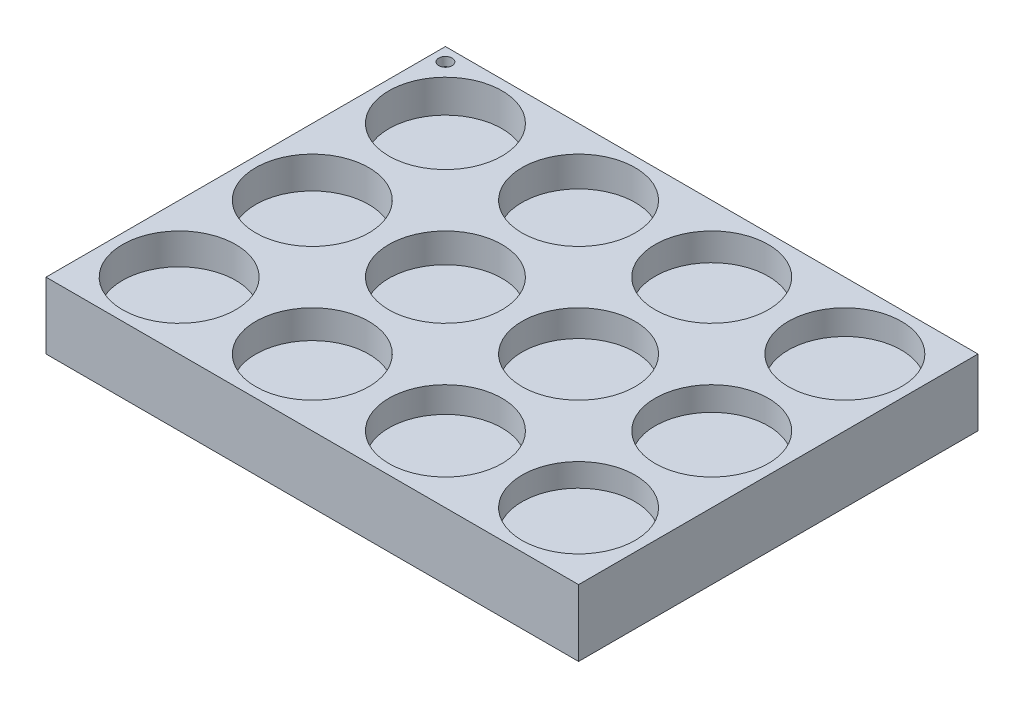
from build123d import *

# Parameters (mm, degrees)
SKETCH1_W           = 120
SKETCH1_H           = 90
SKETCH1_R           = 5
BOSS_EXTRUDE1_DEPTH = 5
SKETCH3_W           = 120
SKETCH3_H           = 90
BOSS_EXTRUDE6_DEPTH = 10
SKETCH2_R           = 12.75
CUT_EXTRUDE1_DEPTH  = 7.4
SKETCH2_8_R         = 12.75
CUT_EXTRUDE2_DEPTH  = 7.2
SKETCH2_9_R         = 12.75
CUT_EXTRUDE3_DEPTH  = 7
SKETCH2_10_R        = 12.75
CUT_EXTRUDE4_DEPTH  = 6.8
SKETCH2_11_R        = 12.75
CUT_EXTRUDE5_DEPTH  = 6.6
SKETCH2_12_R        = 12.75
CUT_EXTRUDE6_DEPTH  = 6.4
SKETCH2_13_R        = 12.75
CUT_EXTRUDE7_DEPTH  = 6.2
SKETCH2_14_R        = 12.75
CUT_EXTRUDE8_DEPTH  = 6
SKETCH2_15_R        = 12.75
CUT_EXTRUDE9_DEPTH  = 5.8
SKETCH2_16_R        = 12.75
CUT_EXTRUDE10_DEPTH = 5.6
SKETCH2_17_R        = 12.75
CUT_EXTRUDE11_DEPTH = 5.4
SKETCH2_18_R        = 12.75
CUT_EXTRUDE12_DEPTH = 5.2
SKETCH4_R           = 1.5
CUT_EXTRUDE13_DEPTH = 2


with BuildPart() as part:
    # Sketch1 → Boss-Extrude1 (new body)
    with BuildSketch(Plane(origin=(0, 0, 0), x_dir=(1, 0, 0), z_dir=(0, 1, 0))):
        Rectangle(SKETCH1_W, SKETCH1_H)
        with Locations(Location((-45, 30, 0), (0, 0, 270))):
            Circle(SKETCH1_R, mode=Mode.SUBTRACT)
        with Locations(Location((-15, 30, 0), (0, 0, 270))):
            Circle(SKETCH1_R, mode=Mode.SUBTRACT)
        with Locations(Location((15, 30, 0), (0, 0, 270))):
            Circle(SKETCH1_R, mode=Mode.SUBTRACT)
        with Locations(Location((45, 30, 0), (0, 0, 270))):
            Circle(SKETCH1_R, mode=Mode.SUBTRACT)
        with Locations(Location((-45, 0, 0), (0, 0, 270))):
            Circle(SKETCH1_R, mode=Mode.SUBTRACT)
        with Locations(Location((-15, 0, 0), (0, 0, 270))):
            Circle(SKETCH1_R, mode=Mode.SUBTRACT)
        with Locations(Location((15, 0, 0), (0, 0, 270))):
            Circle(SKETCH1_R, mode=Mode.SUBTRACT)
        with Locations(Location((45, 0, 0), (0, 0, 270))):
            Circle(SKETCH1_R, mode=Mode.SUBTRACT)
        with Locations(Location((-45, -30, 0), (0, 0, 270))):
            Circle(SKETCH1_R, mode=Mode.SUBTRACT)
        with Locations(Location((-15, -30, 0), (0, 0, 270))):
            Circle(SKETCH1_R, mode=Mode.SUBTRACT)
        with Locations(Location((15, -30, 0), (0, 0, 270))):
            Circle(SKETCH1_R, mode=Mode.SUBTRACT)
        with Locations(Location((45, -30, 0), (0, 0, 270))):
            Circle(SKETCH1_R, mode=Mode.SUBTRACT)
    extrude(amount=BOSS_EXTRUDE1_DEPTH)

    # Sketch3 → Boss-Extrude6 (add)
    with BuildSketch(Plane(origin=(0, 5, 0), x_dir=(1, 0, 0), z_dir=(0, 1, 0))):
        Rectangle(SKETCH3_W, SKETCH3_H)
    extrude(amount=BOSS_EXTRUDE6_DEPTH)

    # Sketch2 → Cut-Extrude1 (cut)
    with BuildSketch(Plane(origin=(0, 15, 0), x_dir=(1, 0, 0), z_dir=(0, 1, 0))):
        with Locations(Location((-45, 30, 0), (0, 0, 270))):
            Circle(SKETCH2_R)
    extrude(amount=-CUT_EXTRUDE1_DEPTH, mode=Mode.SUBTRACT)

    # Sketch2<8> → Cut-Extrude2 (cut)
    with BuildSketch(Plane(origin=(0, 15, 0), x_dir=(1, 0, 0), z_dir=(0, 1, 0))):
        with Locations(Location((-45, 0, 0), (0, 0, 270))):
            Circle(SKETCH2_8_R)
    extrude(amount=-CUT_EXTRUDE2_DEPTH, mode=Mode.SUBTRACT)

    # Sketch2<9> → Cut-Extrude3 (cut)
    with BuildSketch(Plane(origin=(0, 15, 0), x_dir=(1, 0, 0), z_dir=(0, 1, 0))):
        with Locations(Location((-45, -30, 0), (0, 0, 270))):
            Circle(SKETCH2_9_R)
    extrude(amount=-CUT_EXTRUDE3_DEPTH, mode=Mode.SUBTRACT)

    # Sketch2<10> → Cut-Extrude4 (cut)
    with BuildSketch(Plane(origin=(0, 15, 0), x_dir=(1, 0, 0), z_dir=(0, 1, 0))):
        with Locations(Location((-15, 30, 0), (0, 0, 270))):
            Circle(SKETCH2_10_R)
    extrude(amount=-CUT_EXTRUDE4_DEPTH, mode=Mode.SUBTRACT)

    # Sketch2<11> → Cut-Extrude5 (cut)
    with BuildSketch(Plane(origin=(0, 15, 0), x_dir=(1, 0, 0), z_dir=(0, 1, 0))):
        with Locations(Location((-15, 0, 0), (0, 0, 270))):
            Circle(SKETCH2_11_R)
    extrude(amount=-CUT_EXTRUDE5_DEPTH, mode=Mode.SUBTRACT)

    # Sketch2<12> → Cut-Extrude6 (cut)
    with BuildSketch(Plane(origin=(0, 15, 0), x_dir=(1, 0, 0), z_dir=(0, 1, 0))):
        with Locations(Location((-15, -30, 0), (0, 0, 270))):
            Circle(SKETCH2_12_R)
    extrude(amount=-CUT_EXTRUDE6_DEPTH, mode=Mode.SUBTRACT)

    # Sketch2<13> → Cut-Extrude7 (cut)
    with BuildSketch(Plane(origin=(0, 15, 0), x_dir=(1, 0, 0), z_dir=(0, 1, 0))):
        with Locations(Location((15, 30, 0), (0, 0, 270))):
            Circle(SKETCH2_13_R)
    extrude(amount=-CUT_EXTRUDE7_DEPTH, mode=Mode.SUBTRACT)

    # Sketch2<14> → Cut-Extrude8 (cut)
    with BuildSketch(Plane(origin=(0, 15, 0), x_dir=(1, 0, 0), z_dir=(0, 1, 0))):
        with Locations(Location((15, 0, 0), (0, 0, 270))):
            Circle(SKETCH2_14_R)
    extrude(amount=-CUT_EXTRUDE8_DEPTH, mode=Mode.SUBTRACT)

    # Sketch2<15> → Cut-Extrude9 (cut)
    with BuildSketch(Plane(origin=(0, 15, 0), x_dir=(1, 0, 0), z_dir=(0, 1, 0))):
        with Locations(Location((15, -30, 0), (0, 0, 270))):
            Circle(SKETCH2_15_R)
    extrude(amount=-CUT_EXTRUDE9_DEPTH, mode=Mode.SUBTRACT)

    # Sketch2<16> → Cut-Extrude10 (cut)
    with BuildSketch(Plane(origin=(0, 15, 0), x_dir=(1, 0, 0), z_dir=(0, 1, 0))):
        with Locations(Location((45, 30, 0), (0, 0, 270))):
            Circle(SKETCH2_16_R)
    extrude(amount=-CUT_EXTRUDE10_DEPTH, mode=Mode.SUBTRACT)

    # Sketch2<17> → Cut-Extrude11 (cut)
    with BuildSketch(Plane(origin=(0, 15, 0), x_dir=(1, 0, 0), z_dir=(0, 1, 0))):
        with Locations(Location((45, 0, 0), (0, 0, 270))):
            Circle(SKETCH2_17_R)
    extrude(amount=-CUT_EXTRUDE11_DEPTH, mode=Mode.SUBTRACT)

    # Sketch2<18> → Cut-Extrude12 (cut)
    with BuildSketch(Plane(origin=(0, 15, 0), x_dir=(1, 0, 0), z_dir=(0, 1, 0))):
        with Locations(Location((45, -30, 0), (0, 0, 270))):
            Circle(SKETCH2_18_R)
    extrude(amount=-CUT_EXTRUDE12_DEPTH, mode=Mode.SUBTRACT)

    # Sketch4 → Cut-Extrude13 (cut)
    with BuildSketch(Plane(origin=(0, 15, 0), x_dir=(1, 0, 0), z_dir=(0, 1, 0))):
        with Locations(Location((-57.00780573, 42.00780573, 0), (0, 0, 270))):
            Circle(SKETCH4_R)
    extrude(amount=-CUT_EXTRUDE13_DEPTH, mode=Mode.SUBTRACT)


solid = part.part
